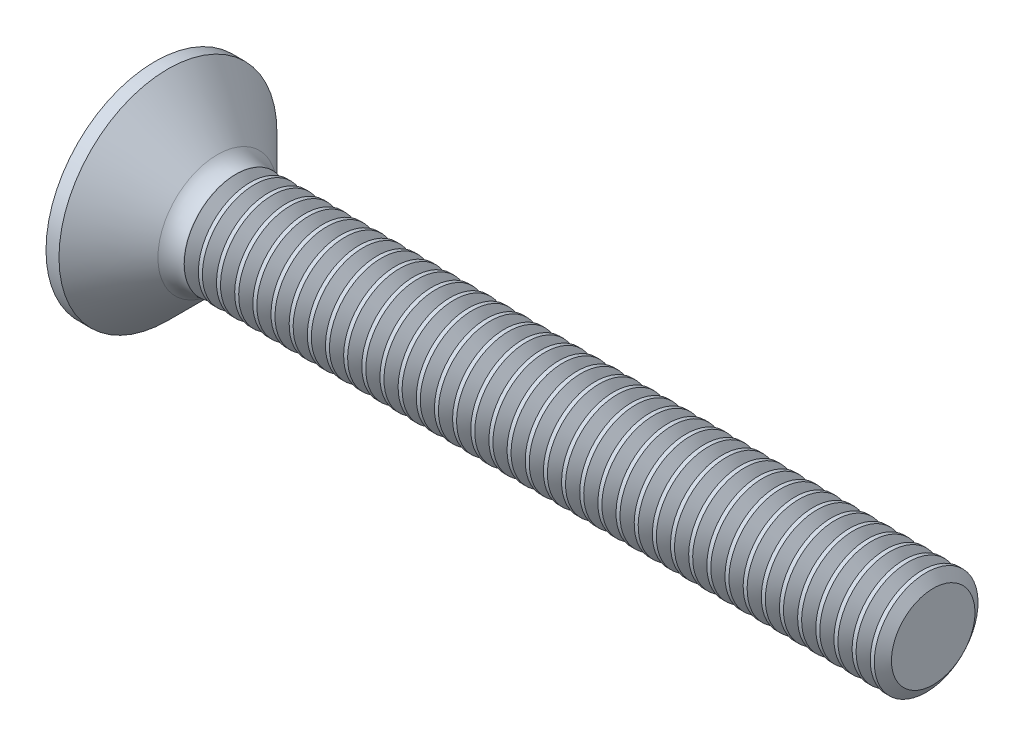
from build123d import *

# Parameters (mm, degrees)
FILLET1_R       = 1
RECPAT_COUNT    = 2
RECPAT_ANGLE    = 90
THDSCHPAT_COUNT = 39
THDSCHPAT_PITCH = 0.7


with BuildPart() as part:
    # BodySke → Base-Revolve (revolve)
    with BuildSketch(Plane.XY, mode=Mode.PRIVATE) as base_revolve_sk:
        with BuildLine():
            Line((0, 0), (31, 0))
            Line((31, 0), (31, 2))
            Line((31, 2), (3.7, 2))
            Line((3.7, 2), (1.5, 4.2))
            Line((1.5, 4.2), (1, 4.2))
            ThreePointArc((1, 4.2), (0.253446079, 2.158703314), (0, 0))
        make_face()
    revolve(base_revolve_sk.sketch.rotate(Axis((-15.875, 0, 0), (1, 0, 0)), 90), axis=Axis((-15.875, 0, 0), (1, 0, 0)))

    # Fillet1
    fillet1_edges = [part.edges().sort_by_distance(p)[0] for p in [
        (3.7, 0, -2),
    ]]
    fillet(fillet1_edges, radius=FILLET1_R)

    # Sketch3 → Recess section 0
    with BuildSketch(Plane(origin=(0, 0, 0), x_dir=(0, 0, -1), z_dir=(1, 0, 0))):
        with BuildLine():
            Line((0.515, -2.5), (-0.515, -2.5))
            Line((-0.515, -2.5), (-0.515, 2.5))
            Line((-0.515, 2.5), (0.515, 2.5))
            Line((0.515, 2.5), (0.515, -2.5))
        make_face()
    # Sketch4 → Recess section 1
    with BuildSketch(Plane(origin=(3.1, 0, 0), x_dir=(0, 0, -1), z_dir=(1, 0, 0))):
        with BuildLine():
            Line((0.515, -0.954397274), (-0.515, -0.954397274))
            Line((-0.515, -0.954397274), (-0.515, 0.954397274))
            Line((-0.515, 0.954397274), (0.515, 0.954397274))
            Line((0.515, 0.954397274), (0.515, -0.954397274))
        make_face()
    recess = loft(mode=Mode.SUBTRACT)

    # RecPat: Recess ×2 about axis
    recpat_axis = Axis((0, 0, 0), (1, 0, 0))
    for i in range(1, RECPAT_COUNT):
        add(recess.rotate(recpat_axis, i * RECPAT_ANGLE / (RECPAT_COUNT - 1)), mode=Mode.SUBTRACT)

    # RecCorSke → RecessCore (revolve, cut)
    with BuildSketch(Plane.XY, mode=Mode.PRIVATE) as recesscore_sk:
        Polygon((0, 0), (0, 1.067773117), (3.1, 0.851), (3.376506661, 0), align=None)
    revolve(recesscore_sk.sketch.rotate(Axis((-3.175, 0, 0), (1, 0, 0)), 90), axis=Axis((-3.175, 0, 0), (1, 0, 0)), mode=Mode.SUBTRACT)

    # ThdSchSke → ThreadSchematic (revolve, cut)
    with BuildSketch(Plane.XY, mode=Mode.PRIVATE) as threadschematic_sk:
        Polygon((4.4, -1.61), (4.12691906, -2), (4.12691906, -2.5), (4.67308094, -2.5), (4.67308094, -2), align=None)
    threadschematic = revolve(threadschematic_sk.sketch.rotate(Axis((-3.175, 0, 0), (1, 0, 0)), 347.60526858), axis=Axis((-3.175, 0, 0), (1, 0, 0)), mode=Mode.SUBTRACT)

    # ThdSchPat: ThreadSchematic ×39
    with Locations(*[(i * THDSCHPAT_PITCH, 0, 0) for i in range(1, THDSCHPAT_COUNT)]):
        add(threadschematic, mode=Mode.SUBTRACT)


solid = part.part
